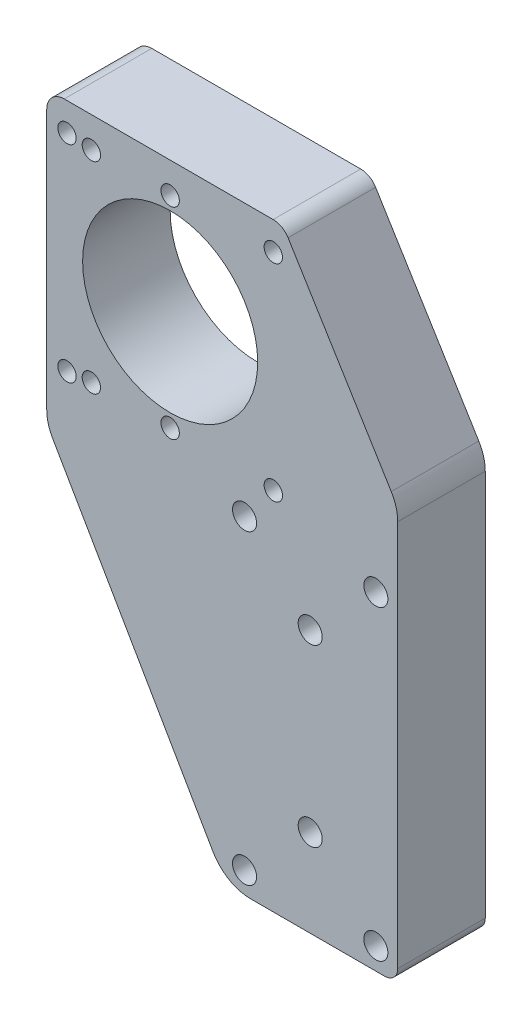
from build123d import *

# Parameters (mm, degrees)
BOSS_EXTRUDE1_DEPTH     = 20
FILLET1_R               = 10
SKETCH2_R               = 20
CUT_EXTRUDE1_DEPTH      = 20
TAP_DRILL_FOR_M5_TAP1_D = 4.2
M5_CLEARANCE_HOLE1_D    = 5.5
TAP_DRILL_FOR_M5_TAP2_D = 4.2
FILLET2_R               = 4


with BuildPart() as part:
    # Sketch1 → Boss-Extrude1 (new body)
    with BuildSketch(Plane.XY):
        with BuildLine():
            Line((-170.200000001, 540.824594888), (-129.309401077, 470))
            Line((-129.309401077, 470), (-93, 470))
            ThreePointArc((-93, 470), (-90.878679656, 470.878679656), (-90, 473))
            Line((-90, 473), (-90, 564.25527297))
            Line((-90, 564.25527297), (-116.225329238, 607))
            Line((-116.225329238, 607), (-170.200000001, 607))
            Line((-170.200000001, 607), (-170.200000001, 540.824594888))
        make_face()
    extrude(amount=BOSS_EXTRUDE1_DEPTH)

    # Fillet1
    fillet1_edges = [part.edges().sort_by_distance(p)[0] for p in [
        (-90, 564.25527297, 10),
        (-129.309401077, 470, 10),
        (-170.200000001, 540.824594888, 10),
    ]]
    fillet(fillet1_edges, radius=FILLET1_R)

    # Sketch2 → Cut-Extrude1 (cut)
    with BuildSketch(Plane.XY.offset(20)):
        with Locations((-142.000000001, 577)):
            Circle(SKETCH2_R)
    extrude(amount=-CUT_EXTRUDE1_DEPTH, mode=Mode.SUBTRACT)

    # Tap Drill for M5 Tap1 (through all)
    with Locations(Plane(origin=(0, 0, 0), x_dir=(-1, 0, 0), z_dir=(0, 0, -1))):
        with Locations((160.000000001, 600), (142.000000001, 600), (142.000000001, 554), (160.000000001, 554)):
            Hole(TAP_DRILL_FOR_M5_TAP1_D / 2)

    # M5 Clearance Hole1 (through all)
    with Locations(Plane.XY.offset(20)):
        with Locations((-95, 545), (-125, 545), (-125, 475), (-95, 475), (-110, 490), (-110, 530)):
            Hole(M5_CLEARANCE_HOLE1_D / 2)

    # Tap Drill for M5 Tap2 (through all)
    with Locations(Plane.XY.offset(20)):
        with Locations((-165.570000001, 553.43), (-165.570000001, 600.57), (-118.430000001, 553.43), (-118.430000001, 600.57)):
            Hole(TAP_DRILL_FOR_M5_TAP2_D / 2)

    # Fillet2
    fillet2_edges = [part.edges().sort_by_distance(p)[0] for p in [
        (-116.225329238, 607, 10),
        (-170.200000001, 607, 10),
    ]]
    fillet(fillet2_edges, radius=FILLET2_R)


solid = part.part
